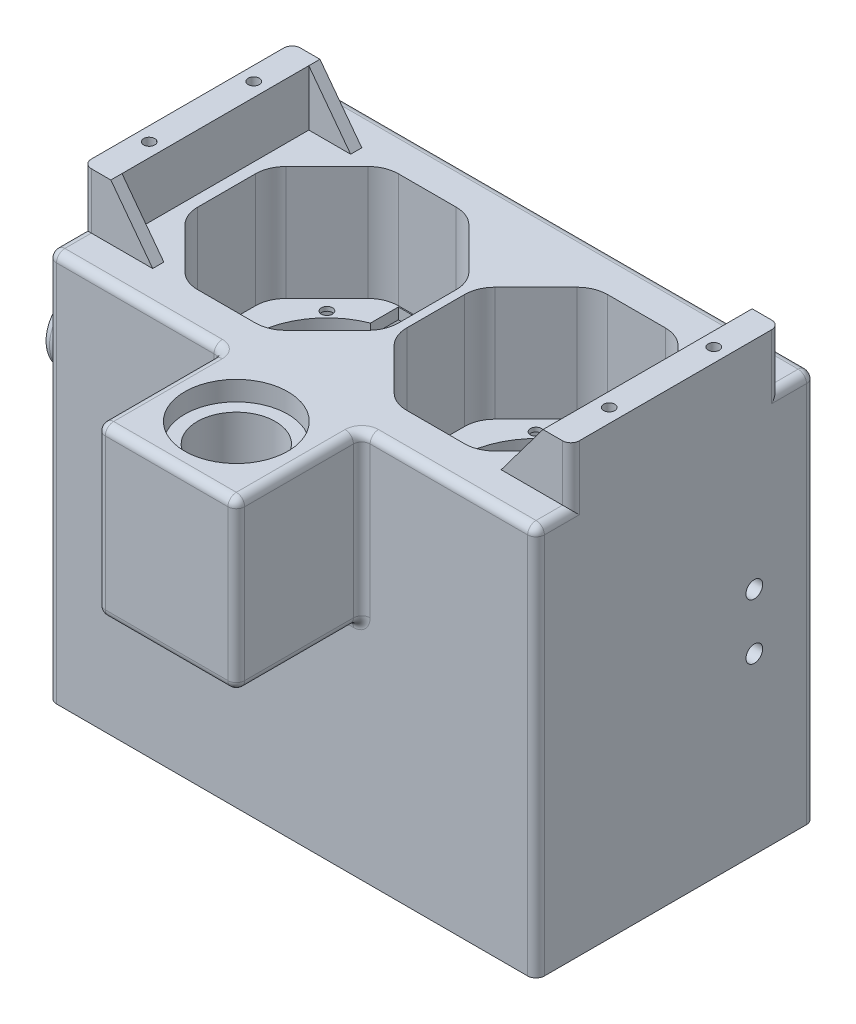
from build123d import *

# Parameters (mm, degrees)
SKETCH1_W           = 175
SKETCH1_H           = 100
BOSS_EXTRUDE1_DEPTH = 45
CUT_EXTRUDE1_DEPTH  = 41
CUT_EXTRUDE2_DEPTH  = 111.368700273
SKETCH4_W           = 175
SKETCH4_H           = 100
SKETCH4_W_2         = 155
SKETCH4_H_2         = 80
BOSS_EXTRUDE2_DEPTH = 95
SKETCH5_R           = 2.5
CUT_EXTRUDE3_DEPTH  = 5
SKETCH6_R           = 2
CUT_EXTRUDE4_DEPTH  = 15
CUT_EXTRUDE5_DEPTH  = 2.5
SKETCH8_R           = 2
CUT_EXTRUDE6_DEPTH  = 139.496389845
SKETCH10_R          = 3
CUT_EXTRUDE7_DEPTH  = 30
CUT_EXTRUDE8_DEPTH  = 4
SKETCH12_R          = 12.5
BOSS_EXTRUDE4_DEPTH = 40
SKETCH13_W          = 10
SKETCH13_H          = 75
BOSS_EXTRUDE5_DEPTH = 20
BOSS_EXTRUDE6_DEPTH = 4
SKETCH15_R          = 2
CUT_EXTRUDE9_DEPTH  = 15
SKETCH16_W          = 50
SKETCH16_H          = 45
BOSS_EXTRUDE8_DEPTH = 60
SKETCH17_R          = 18.5
CUT_EXTRUDE10_DEPTH = 7
SKETCH18_R          = 14
CUT_EXTRUDE11_DEPTH = 25
FILLET1_R           = 3


with BuildPart() as part:
    # Sketch1 → Boss-Extrude1 (new body)
    with BuildSketch(Plane(origin=(0, 0, 0), x_dir=(1, 0, 0), z_dir=(0, 1, 0))):
        Rectangle(SKETCH1_W, SKETCH1_H)
    extrude(amount=BOSS_EXTRUDE1_DEPTH)

    # Sketch2 → Cut-Extrude1 (cut)
    with BuildSketch(Plane(origin=(0, 45, 0), x_dir=(1, 0, 0), z_dir=(0, 1, 0))):
        with BuildLine():
            Line((-19.366486348, -32.778174593), (-4.721825407, -18.133513652))
            ThreePointArc((-4.721825407, -18.133513652), (-2.337325142, -14.564856815), (-1.5, -10.355339059))
            Line((-1.5, -10.355339059), (-1.5, 10.355339059))
            ThreePointArc((-1.5, 10.355339059), (-2.337325142, 14.564856815), (-4.721825407, 18.133513652))
            Line((-4.721825407, 18.133513652), (-19.366486348, 32.778174593))
            ThreePointArc((-19.366486348, 32.778174593), (-22.935143185, 35.162674858), (-27.144660941, 36))
            Line((-27.144660941, 36), (-47.855339059, 36))
            ThreePointArc((-47.855339059, 36), (-52.064856815, 35.162674858), (-55.633513652, 32.778174593))
            Line((-55.633513652, 32.778174593), (-70.278174593, 18.133513652))
            ThreePointArc((-70.278174593, 18.133513652), (-72.662674858, 14.564856815), (-73.5, 10.355339059))
            Line((-73.5, 10.355339059), (-73.5, -10.355339059))
            ThreePointArc((-73.5, -10.355339059), (-72.662674858, -14.564856815), (-70.278174593, -18.133513652))
            Line((-70.278174593, -18.133513652), (-55.633513652, -32.778174593))
            ThreePointArc((-55.633513652, -32.778174593), (-52.064856815, -35.162674858), (-47.855339059, -36))
            Line((-47.855339059, -36), (-27.144660941, -36))
            ThreePointArc((-27.144660941, -36), (-22.935143185, -35.162674858), (-19.366486348, -32.778174593))
        make_face()
        with BuildLine():
            Line((55.633513652, -32.778174593), (70.278174593, -18.133513652))
            ThreePointArc((70.278174593, -18.133513652), (72.662674858, -14.564856815), (73.5, -10.355339059))
            Line((73.5, -10.355339059), (73.5, 10.355339059))
            ThreePointArc((73.5, 10.355339059), (72.662674858, 14.564856815), (70.278174593, 18.133513652))
            Line((70.278174593, 18.133513652), (55.633513652, 32.778174593))
            ThreePointArc((55.633513652, 32.778174593), (52.064856815, 35.162674858), (47.855339059, 36))
            Line((47.855339059, 36), (27.144660941, 36))
            ThreePointArc((27.144660941, 36), (22.935143185, 35.162674858), (19.366486348, 32.778174593))
            Line((19.366486348, 32.778174593), (4.721825407, 18.133513652))
            ThreePointArc((4.721825407, 18.133513652), (2.337325142, 14.564856815), (1.5, 10.355339059))
            Line((1.5, 10.355339059), (1.5, -10.355339059))
            ThreePointArc((1.5, -10.355339059), (2.337325142, -14.564856815), (4.721825407, -18.133513652))
            Line((4.721825407, -18.133513652), (19.366486348, -32.778174593))
            ThreePointArc((19.366486348, -32.778174593), (22.935143185, -35.162674858), (27.144660941, -36))
            Line((27.144660941, -36), (47.855339059, -36))
            ThreePointArc((47.855339059, -36), (52.064856815, -35.162674858), (55.633513652, -32.778174593))
        make_face()
    extrude(amount=-CUT_EXTRUDE1_DEPTH, mode=Mode.SUBTRACT)

    # Sketch3 → Cut-Extrude2 (cut, through all)
    with BuildSketch(Plane(origin=(0, 45, 0), x_dir=(1, 0, 0), z_dir=(0, 1, 0))):
        with BuildLine():
            Line((-27.5, 35.617376915), (-47.5, 35.617376915))
            Line((-47.5, 35.617376915), (-47.5, 25.617376915))
            ThreePointArc((-47.5, 25.617376915), (-37.5, -27.5), (-27.5, 25.617376915))
            Line((-27.5, 25.617376915), (-27.5, 35.617376915))
        make_face()
        with BuildLine():
            Line((47.5, 35.617376915), (27.5, 35.617376915))
            Line((27.5, 35.617376915), (27.5, 25.617376915))
            ThreePointArc((27.5, 25.617376915), (37.5, -27.5), (47.5, 25.617376915))
            Line((47.5, 25.617376915), (47.5, 35.617376915))
        make_face()
    extrude(amount=-CUT_EXTRUDE2_DEPTH, mode=Mode.SUBTRACT)

    # Sketch4 → Boss-Extrude2 (add)
    with BuildSketch(Plane.XZ):
        Rectangle(SKETCH4_W, SKETCH4_H)
        Rectangle(SKETCH4_W_2, SKETCH4_H_2, mode=Mode.SUBTRACT)
    extrude(amount=BOSS_EXTRUDE2_DEPTH)

    # Sketch5 → Cut-Extrude3 (cut)
    with BuildSketch(Plane.XZ.offset(95)):
        with Locations(Location((-82.5, 45, 0), (0, 0, 270))):
            Circle(SKETCH5_R)
        with Locations(Location((82.5, 45, 0), (0, 0, 90))):
            Circle(SKETCH5_R)
        with Locations(Location((82.5, -45, 0), (0, 0, 270))):
            Circle(SKETCH5_R)
        with Locations(Location((-82.5, -45, 0), (0, 0, 90))):
            Circle(SKETCH5_R)
    extrude(amount=-CUT_EXTRUDE3_DEPTH, mode=Mode.SUBTRACT)

    # Sketch6 → Cut-Extrude4 (cut)
    with BuildSketch(Plane.XZ.offset(95)):
        with Locations(Location((-82.5, 45, 0), (0, 0, 270))):
            Circle(SKETCH6_R)
        with Locations(Location((82.5, 45, 0), (0, 0, 90))):
            Circle(SKETCH6_R)
        with Locations(Location((82.5, -45, 0), (0, 0, 270))):
            Circle(SKETCH6_R)
        with Locations(Location((-82.5, -45, 0), (0, 0, 90))):
            Circle(SKETCH6_R)
    extrude(amount=-CUT_EXTRUDE4_DEPTH, mode=Mode.SUBTRACT)

    # Sketch7 → Cut-Extrude5 (cut)
    with BuildSketch(Plane.XZ):
        Polygon((-16.755104023, 18.499530379), (-19.000469621, 20.744895977), (-18.178608771, 23.812122424), (-15.111382324, 24.633983273), (-12.866016727, 22.388617676), (-13.687877576, 19.321391229), align=None)
        Polygon((-55.999530379, 20.744895977), (-56.821391229, 23.812122424), (-59.888617676, 24.633983273), (-62.133983273, 22.388617676), (-61.312122424, 19.321391229), (-58.244895977, 18.499530379), align=None)
        Polygon((-19.000469621, -20.744895977), (-18.178608771, -23.812122424), (-15.111382324, -24.633983273), (-12.866016727, -22.388617676), (-13.687877576, -19.321391229), (-16.755104023, -18.499530379), align=None)
        Polygon((-58.244895977, -18.499530379), (-55.999530379, -20.744895977), (-56.821391229, -23.812122424), (-59.888617676, -24.633983273), (-62.133983273, -22.388617676), (-61.312122424, -19.321391229), align=None)
        Polygon((16.755104023, -18.499530379), (19.000469621, -20.744895977), (18.178608771, -23.812122424), (15.111382324, -24.633983273), (12.866016727, -22.388617676), (13.687877576, -19.321391229), align=None)
        Polygon((55.999530379, -20.744895977), (56.821391229, -23.812122424), (59.888617676, -24.633983273), (62.133983273, -22.388617676), (61.312122424, -19.321391229), (58.244895977, -18.499530379), align=None)
        Polygon((19.000469621, 20.744895977), (18.178608771, 23.812122424), (15.111382324, 24.633983273), (12.866016727, 22.388617676), (13.687877576, 19.321391229), (16.755104023, 18.499530379), align=None)
        Polygon((58.244895977, 18.499530379), (55.999530379, 20.744895977), (56.821391229, 23.812122424), (59.888617676, 24.633983273), (62.133983273, 22.388617676), (61.312122424, 19.321391229), align=None)
    extrude(amount=-CUT_EXTRUDE5_DEPTH, mode=Mode.SUBTRACT)

    # Sketch8 → Cut-Extrude6 (cut, through all)
    with BuildSketch(Plane.XZ):
        with Locations(Location((-59.066756826, 21.566756826, 0), (0, 0, 270))):
            Circle(SKETCH8_R)
        with Locations(Location((-15.933243174, 21.566756826, 0), (0, 0, 270))):
            Circle(SKETCH8_R)
        with Locations(Location((-15.933243174, -21.566756826, 0), (0, 0, 270))):
            Circle(SKETCH8_R)
        with Locations(Location((-59.066756826, -21.566756826, 0), (0, 0, 270))):
            Circle(SKETCH8_R)
        with Locations(Location((59.066756826, -21.566756826, 0), (0, 0, 270))):
            Circle(SKETCH8_R)
        with Locations(Location((15.933243174, -21.566756826, 0), (0, 0, 270))):
            Circle(SKETCH8_R)
        with Locations(Location((15.933243174, 21.566756826, 0), (0, 0, 270))):
            Circle(SKETCH8_R)
        with Locations(Location((59.066756826, 21.566756826, 0), (0, 0, 270))):
            Circle(SKETCH8_R)
    extrude(amount=-CUT_EXTRUDE6_DEPTH, mode=Mode.SUBTRACT)

    # Sketch10 → Cut-Extrude7 (cut)
    with BuildSketch(Plane(origin=(87.5, 0, 0), x_dir=(0, 0, -1), z_dir=(1, 0, 0))):
        with Locations(Location((28.284271247, -12.5, 0), (0, 0, 180))):
            Circle(SKETCH10_R)
        with Locations((28.284271247, -32.5)):
            Circle(SKETCH10_R)
    extrude(amount=-CUT_EXTRUDE7_DEPTH, mode=Mode.SUBTRACT)

    # Sketch11 → Cut-Extrude8 (cut)
    with BuildSketch(Plane.ZY.offset(-77.5)):
        Polygon((-24.284271247, -14.809401077), (-24.284271247, -10.190598923), (-28.284271247, -7.881197846), (-32.284271247, -10.190598923), (-32.284271247, -14.809401077), (-28.284271247, -17.118802154), align=None)
        Polygon((-24.284271247, -34.809401077), (-24.284271247, -30.190598923), (-28.284271247, -27.881197846), (-32.284271247, -30.190598923), (-32.284271247, -34.809401077), (-28.284271247, -37.118802154), align=None)
    extrude(amount=-CUT_EXTRUDE8_DEPTH, mode=Mode.SUBTRACT)

    # Sketch12 → Boss-Extrude4 (add)
    with BuildSketch(Plane.ZY.offset(87.5)):
        with Locations((0, -22.5)):
            Circle(SKETCH12_R)
    extrude(amount=BOSS_EXTRUDE4_DEPTH)

    # Sketch13 → Boss-Extrude5 (add)
    with BuildSketch(Plane(origin=(0, 45, 0), x_dir=(1, 0, 0), z_dir=(0, 1, 0))):
        with Locations((-82.5, 0)):
            Rectangle(SKETCH13_W, SKETCH13_H)
        with Locations((82.5, 0)):
            Rectangle(SKETCH13_W, SKETCH13_H)
    extrude(amount=BOSS_EXTRUDE5_DEPTH)

    # Sketch14 → Boss-Extrude6 (add)
    with BuildSketch(Plane.XY.offset(37.5)):
        Polygon((-77.5, 65), (-77.5, 45), (-62.5, 45), align=None)
        Polygon((77.5, 45), (62.5, 45), (77.5, 65), align=None)
    boss_extrude6 = extrude(amount=-BOSS_EXTRUDE6_DEPTH)

    # Mirror1: Boss-Extrude6 across plane
    add(boss_extrude6.mirror(Plane.XY))

    # Sketch15 → Cut-Extrude9 (cut)
    with BuildSketch(Plane(origin=(0, 65, 0), x_dir=(1, 0, 0), z_dir=(0, 1, 0))):
        with Locations(Location((-82.5, 18.75, 0), (0, 0, 270))):
            Circle(SKETCH15_R)
        with Locations(Location((-82.5, -18.75, 0), (0, 0, 90))):
            Circle(SKETCH15_R)
        with Locations(Location((82.5, -18.75, 0), (0, 0, 270))):
            Circle(SKETCH15_R)
        with Locations(Location((82.5, 18.75, 0), (0, 0, 90))):
            Circle(SKETCH15_R)
    extrude(amount=-CUT_EXTRUDE9_DEPTH, mode=Mode.SUBTRACT)

    # Sketch16 → Boss-Extrude8 (add)
    with BuildSketch(Plane(origin=(0, 45, 0), x_dir=(1, 0, 0), z_dir=(0, 1, 0))):
        with Locations((0, -72.5)):
            Rectangle(SKETCH16_W, SKETCH16_H)
    extrude(amount=-BOSS_EXTRUDE8_DEPTH)

    # Sketch17 → Cut-Extrude10 (cut)
    with BuildSketch(Plane(origin=(0, 45, 0), x_dir=(1, 0, 0), z_dir=(0, 1, 0))):
        with Locations(Location((0, -70, 0), (0, 0, 270))):
            Circle(SKETCH17_R)
    extrude(amount=-CUT_EXTRUDE10_DEPTH, mode=Mode.SUBTRACT)

    # Sketch18 → Cut-Extrude11 (cut)
    with BuildSketch(Plane(origin=(0, 45, 0), x_dir=(1, 0, 0), z_dir=(0, 1, 0))):
        with Locations(Location((0, -70, 0), (0, 0, 270))):
            Circle(SKETCH18_R)
    extrude(amount=-CUT_EXTRUDE11_DEPTH, mode=Mode.SUBTRACT)

    # Fillet1
    fillet1_edges = [part.edges().sort_by_distance(p)[0] for p in [
        (-87.5, 45, -43.75),
        (-56.25, 45, 50),
        (-127.5, -22.5, -12.5),
        (-87.5, 45, 43.75),
        (-87.5, 55, -37.5),
        (-87.5, 55, 37.5),
        (87.5, 45, -43.75),
        (87.5, 55, 37.5),
        (87.5, 55, -37.5),
        (87.5, 45, 43.75),
        (56.25, 45, 50),
        (25, -15, 72.5),
        (25, 15, 50),
        (0, -15, 95),
        (25, 15, 95),
        (-25, -15, 72.5),
        (-25, 15, 95),
        (0, -15, 50),
        (-25, 15, 50),
        (25, 45, 72.5),
        (-25, 45, 72.5),
        (0, 45, 95),
        (87.5, -25, 50),
        (-87.5, -25, 50),
        (-87.5, -25, -50),
        (87.5, -25, -50),
        (0, 45, -50),
    ]]
    fillet(fillet1_edges, radius=FILLET1_R)


solid = part.part
